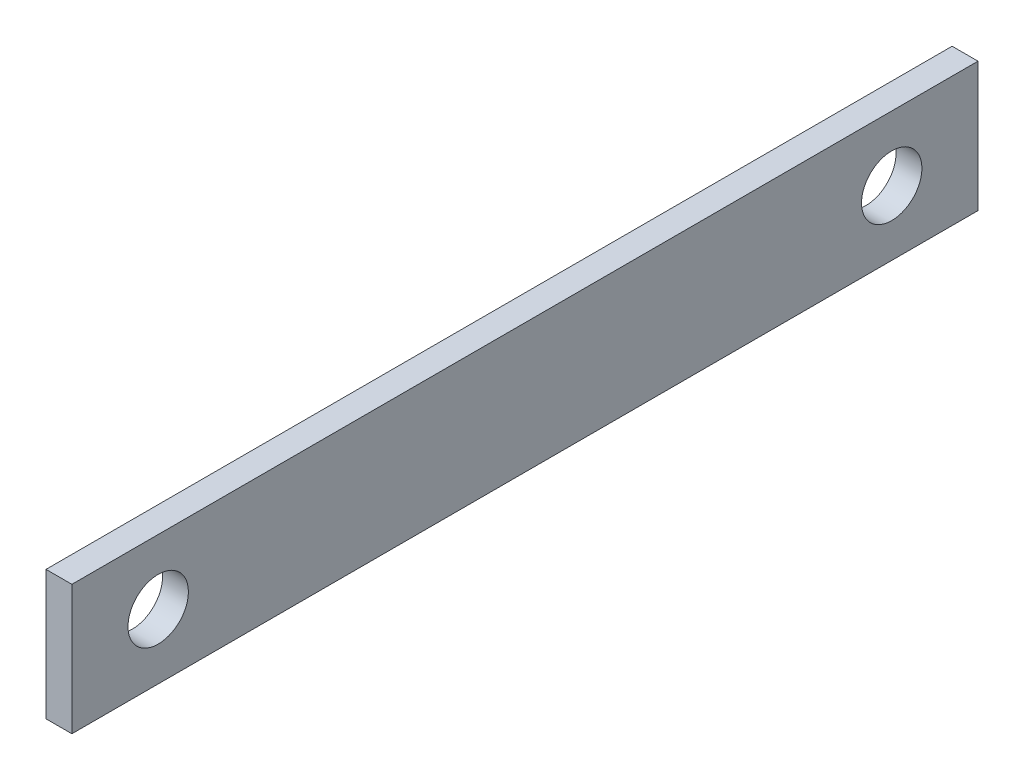
from build123d import *

# Parameters (mm, degrees)
SKETCH1_W           = 210
SKETCH1_H           = 30
SKETCH1_R           = 7
BOSS_EXTRUDE1_DEPTH = 6


with BuildPart() as part:
    # Sketch1 → Boss-Extrude1 (new body)
    with BuildSketch(Plane(origin=(0, 0, 0), x_dir=(0, 0, -1), z_dir=(1, 0, 0))):
        Rectangle(SKETCH1_W, SKETCH1_H)
        with Locations((-85, 0)):
            Circle(SKETCH1_R, mode=Mode.SUBTRACT)
        with Locations((85, 0)):
            Circle(SKETCH1_R, mode=Mode.SUBTRACT)
    extrude(amount=BOSS_EXTRUDE1_DEPTH)


solid = part.part
